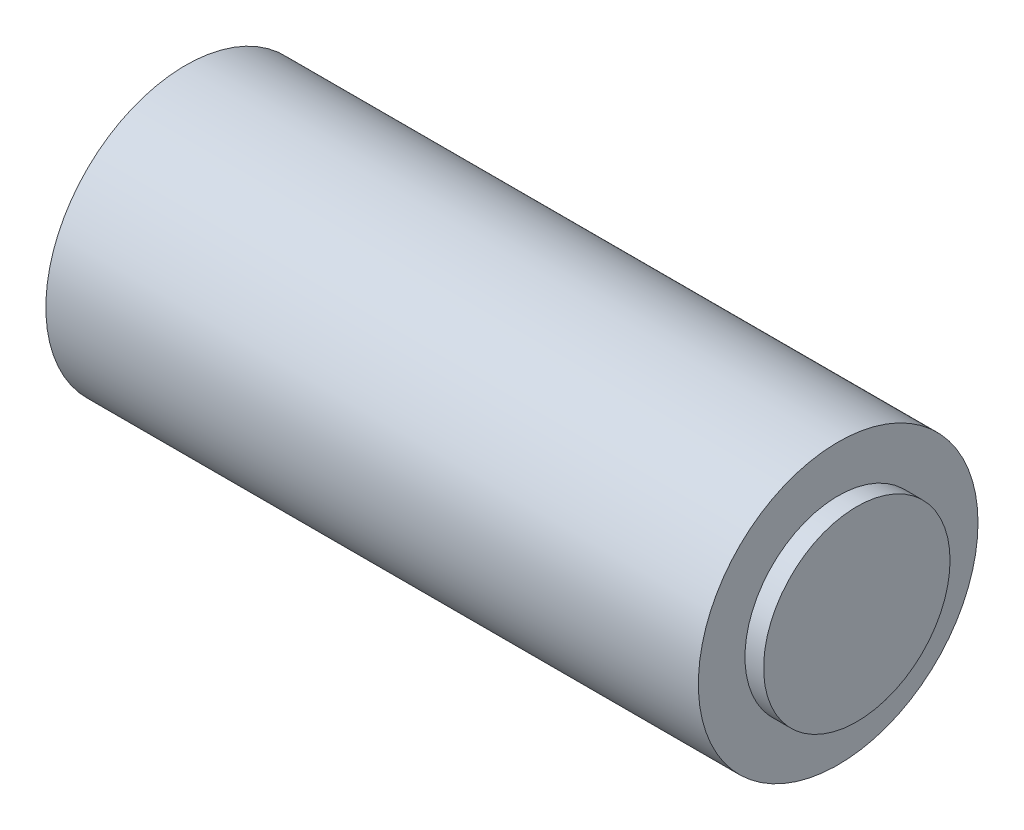
from build123d import *


with BuildPart() as part:
    # Sketch1 → Revolve1 (revolve)
    with BuildSketch(Plane(origin=(0, 0, 0), x_dir=(1, 0, 0), z_dir=(0, 1, 0)), mode=Mode.PRIVATE) as revolve1_sk:
        Polygon((0, 0), (0, -5), (-1, -5), (-1, -7.5), (34, -7.5), (34, -5), (35, -5), (35, 0), align=None)
    revolve(revolve1_sk.sketch.rotate(Axis((35, 0, 0), (-1, 0, 0)), 180), axis=Axis((35, 0, 0), (-1, 0, 0)))


solid = part.part
